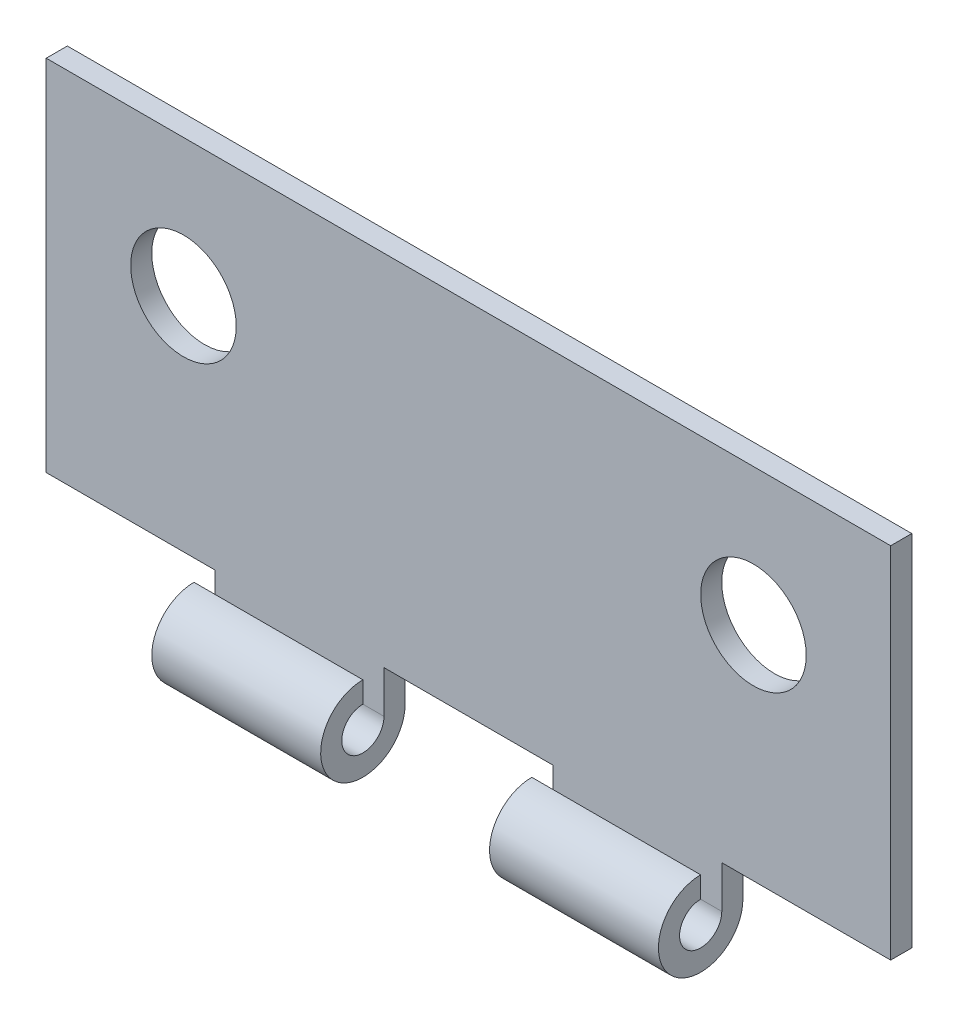
from build123d import *

# Parameters (mm, degrees)
ESQUISSE1_W             = 40
ESQUISSE1_H             = 17
BOSS_EXTRU_1_DEPTH      = 1
ENL_V_MAT_EXTRU_1_REACH = 45.474
ESQUISSE2_R             = 2.5
BOSS_EXTRU_2_DEPTH      = 8


with BuildPart() as part:
    # Esquisse1 → Boss.-Extru.1 (new body)
    with BuildSketch(Plane.XY):
        with Locations((20, 8.5)):
            Rectangle(ESQUISSE1_W, ESQUISSE1_H)
    extrude(amount=BOSS_EXTRU_1_DEPTH)

    # Esquisse2 → Enlèv. mat.-Extru.1 (cut, up to next)
    with BuildSketch(Plane.XY.offset(1), mode=Mode.PRIVATE) as enl_v_mat_extru_1_sk1:
        with Locations((6.5, 10.5)):
            Circle(ESQUISSE2_R)
    enl_v_mat_extru_1_tool1 = extrude(enl_v_mat_extru_1_sk1.sketch, amount=-ENL_V_MAT_EXTRU_1_REACH, mode=Mode.PRIVATE) & part.part
    # Esquisse2 → Enlèv. mat.-Extru.1 (cut, up to next)
    with BuildSketch(Plane.XY.offset(1), mode=Mode.PRIVATE) as enl_v_mat_extru_1_sk2:
        with Locations((33.5, 10.5)):
            Circle(ESQUISSE2_R)
    enl_v_mat_extru_1_tool2 = extrude(enl_v_mat_extru_1_sk2.sketch, amount=-ENL_V_MAT_EXTRU_1_REACH, mode=Mode.PRIVATE) & part.part
    add(enl_v_mat_extru_1_tool1.solids().sort_by_distance((6.5, 10.5, 1))[0], mode=Mode.SUBTRACT)
    add(enl_v_mat_extru_1_tool2.solids().sort_by_distance((33.5, 10.5, 1))[0], mode=Mode.SUBTRACT)

    # Esquisse3 → Boss.-Extru.2 (add)
    with BuildSketch(Plane.ZY.offset(-8)):
        with BuildLine():
            Line((0, 0), (0, -2))
            ThreePointArc((0, -2), (3.414213562, -3.414213562), (2, 0))
            Line((2, 0), (2, -1))
            ThreePointArc((2, -1), (2.707106781, -2.707106781), (1, -2))
            Line((1, -2), (1, 0))
            Line((1, 0), (0, 0))
        make_face()
    boss_extru_2 = extrude(amount=-BOSS_EXTRU_2_DEPTH)

    # Symétrie1: Boss.-Extru.2 across plane
    add(boss_extru_2.mirror(Plane.ZY.offset(-20)))


solid = part.part
